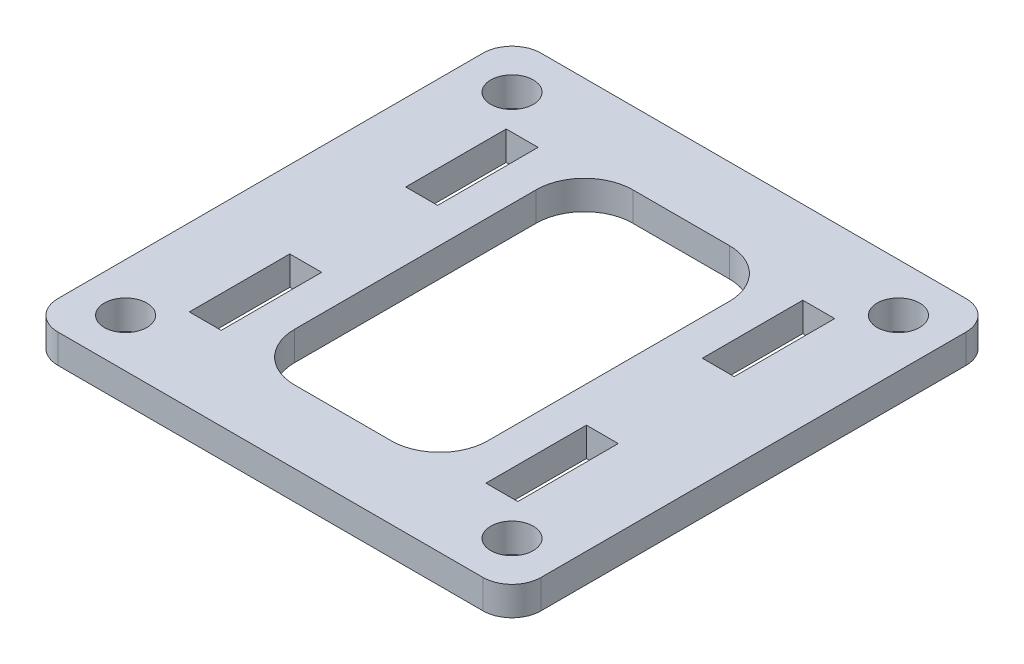
from build123d import *

# Parameters (mm, degrees)
SKETCH_1_W          = 50
SKETCH_1_H          = 50
SKETCH_1_W_2        = 3.3
SKETCH_1_H_2        = 10.4
EXTRUDE_1_DEPTH     = 3
SKETCH_2_W          = 20
SKETCH_2_H          = 35
CUT_EXTRUDE_1_DEPTH = 3
FILLET_1_R          = 5
SKETCH_3_R          = 2.2
CUT_EXTRUDE_2_DEPTH = 3
FILLET_2_R          = 3


with BuildPart() as part:
    # 草图1 → 凸台-拉伸1 (new body)
    with BuildSketch(Plane(origin=(0, 0, 0), x_dir=(1, 0, 0), z_dir=(0, 1, 0))):
        Rectangle(SKETCH_1_W, SKETCH_1_H)
        with Locations((15.35, 11.2)):
            Rectangle(SKETCH_1_W_2, SKETCH_1_H_2, mode=Mode.SUBTRACT)
        with Locations((15.35, -11.2)):
            Rectangle(SKETCH_1_W_2, SKETCH_1_H_2, mode=Mode.SUBTRACT)
        with Locations((-15.35, -11.2)):
            Rectangle(SKETCH_1_W_2, SKETCH_1_H_2, mode=Mode.SUBTRACT)
        with Locations((-15.35, 11.2)):
            Rectangle(SKETCH_1_W_2, SKETCH_1_H_2, mode=Mode.SUBTRACT)
    extrude(amount=EXTRUDE_1_DEPTH)

    # 草图2 → 切除-拉伸1 (cut)
    with BuildSketch(Plane(origin=(0, 3, 0), x_dir=(1, 0, 0), z_dir=(0, 1, 0))):
        Rectangle(SKETCH_2_W, SKETCH_2_H)
    extrude(amount=-CUT_EXTRUDE_1_DEPTH, mode=Mode.SUBTRACT)

    # 圆角1
    fillet_1_edges = [part.edges().sort_by_distance(p)[0] for p in [
        (10, 1.5, -17.5),
        (10, 1.5, 17.5),
        (-10, 1.5, 17.5),
        (-10, 1.5, -17.5),
    ]]
    fillet(fillet_1_edges, radius=FILLET_1_R)

    # 草图3 → 切除-拉伸2 (cut)
    with BuildSketch(Plane(origin=(0, 3, 0), x_dir=(1, 0, 0), z_dir=(0, 1, 0))):
        with Locations(Location((-20, 20, 0), (0, 0, 270))):
            Circle(SKETCH_3_R)
        with Locations(Location((20, 20, 0), (0, 0, 270))):
            Circle(SKETCH_3_R)
        with Locations(Location((20, -20, 0), (0, 0, 270))):
            Circle(SKETCH_3_R)
        with Locations(Location((-20, -20, 0), (0, 0, 270))):
            Circle(SKETCH_3_R)
    extrude(amount=-CUT_EXTRUDE_2_DEPTH, mode=Mode.SUBTRACT)

    # 圆角2
    fillet_2_edges = [part.edges().sort_by_distance(p)[0] for p in [
        (25, 1.5, 25),
        (-25, 1.5, 25),
        (-25, 1.5, -25),
        (25, 1.5, -25),
    ]]
    fillet(fillet_2_edges, radius=FILLET_2_R)


solid = part.part
